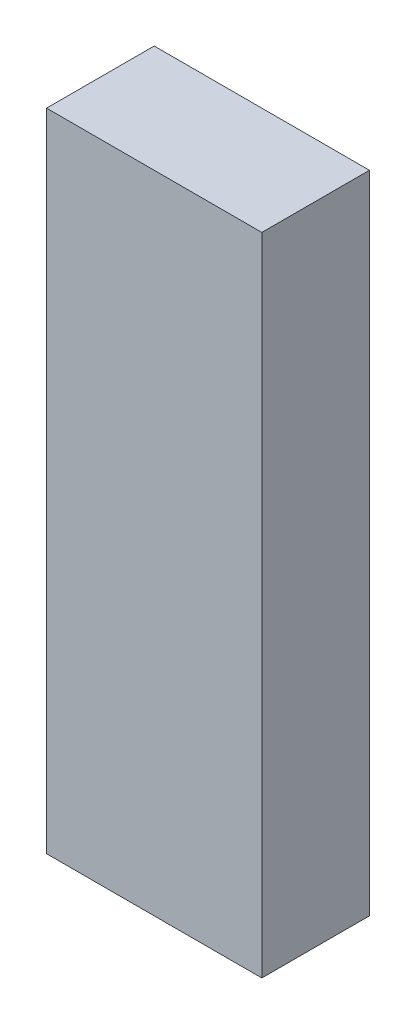
from build123d import *

# Parameters (mm, degrees)
SKETCH1_W           = 101.6
SKETCH1_H           = 50.8
BOSS_EXTRUDE1_DEPTH = 304.8


with BuildPart() as part:
    # Sketch1 → Boss-Extrude1 (new body)
    with BuildSketch(Plane(origin=(0, 0, 0), x_dir=(1, 0, 0), z_dir=(0, 1, 0))):
        with Locations((-8.514057299, 11.850869895)):
            Rectangle(SKETCH1_W, SKETCH1_H)
    extrude(amount=BOSS_EXTRUDE1_DEPTH)


solid = part.part
